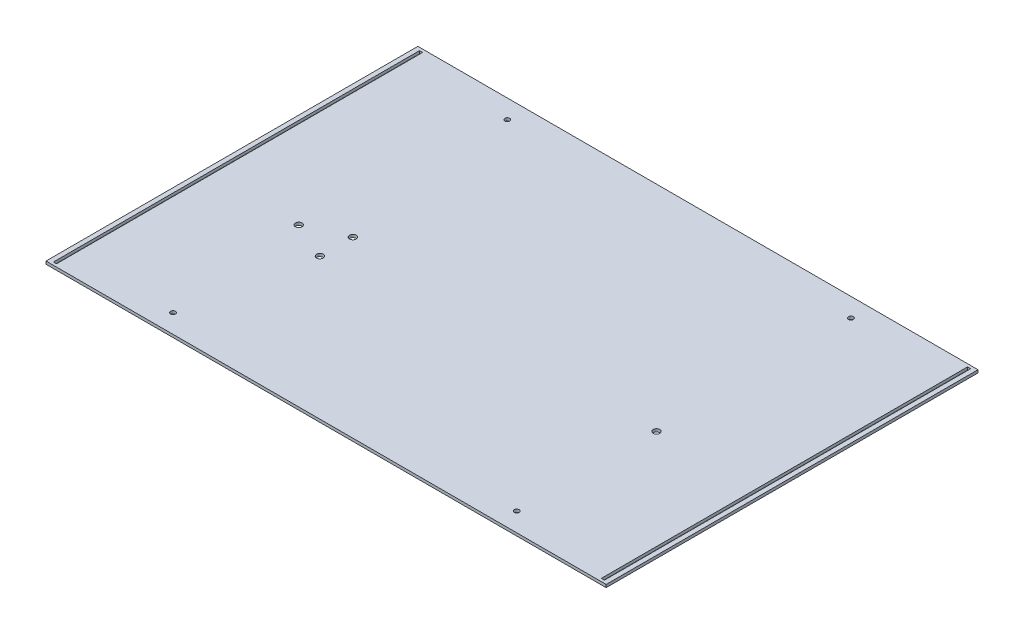
from build123d import *

# Parameters (mm, degrees)
SKETCH1_W               = 595
SKETCH1_H               = 395
BOSS_EXTRUDE1_DEPTH     = 3
CUT_EXTRUDE1_DEPTH      = 358.10152618
CUT_EXTRUDE1_DEPTH_BACK = 358.10152618
SKETCH2_R               = 3.55
CUT_EXTRUDE2_DEPTH      = 358.10152618
CUT_EXTRUDE2_DEPTH_BACK = 358.10152618
SKETCH3_W               = 3.3
SKETCH3_H               = 389
CUT_EXTRUDE3_DEPTH      = 358.10152618
CUT_EXTRUDE3_DEPTH_BACK = 358.10152618
SKETCH4_R               = 2.6


with BuildPart() as part:
    # Sketch1 → Boss-Extrude1 (new body)
    with BuildSketch(Plane(origin=(0, 0, 0), x_dir=(1, 0, 0), z_dir=(0, 1, 0))):
        Rectangle(SKETCH1_W, SKETCH1_H)
    extrude(amount=BOSS_EXTRUDE1_DEPTH)

    # Sketch2 → Cut-Extrude1 (cut, two sides: drawn at the far end of the back side and taken through both)
    with BuildSketch(Plane(origin=(0, 3, 0), x_dir=(1, 0, 0), z_dir=(0, 1, 0)).offset(-CUT_EXTRUDE1_DEPTH_BACK)):
        with Locations(Location((-196.5, -30, 0), (0, 0, 270))):
            Circle(SKETCH2_R)
        with Locations(Location((-156.5, -47.5, 0), (0, 0, 270))):
            Circle(SKETCH2_R)
        with Locations(Location((-156.5, -12.5, 0), (0, 0, 270))):
            Circle(SKETCH2_R)
        with Locations(Location((183.5, -30, 0), (0, 0, 270))):
            Circle(SKETCH2_R)
    extrude(amount=CUT_EXTRUDE1_DEPTH + CUT_EXTRUDE1_DEPTH_BACK, mode=Mode.SUBTRACT)

    # Sketch3 → Cut-Extrude2 (cut, two sides: drawn at the far end of the back side and taken through both)
    with BuildSketch(Plane(origin=(0, 3, 0), x_dir=(1, 0, 0), z_dir=(0, 1, 0)).offset(-CUT_EXTRUDE2_DEPTH_BACK)):
        with Locations((291, 0)):
            Rectangle(SKETCH3_W, SKETCH3_H)
        with Locations((-291, 0)):
            Rectangle(SKETCH3_W, SKETCH3_H)
    extrude(amount=CUT_EXTRUDE2_DEPTH + CUT_EXTRUDE2_DEPTH_BACK, mode=Mode.SUBTRACT)

    # Sketch4 → Cut-Extrude3 (cut, two sides: drawn at the far end of the back side and taken through both)
    with BuildSketch(Plane(origin=(0, 0, 0), x_dir=(-1, 0, 0), z_dir=(0, -1, 0)).offset(-CUT_EXTRUDE3_DEPTH_BACK)):
        with Locations(Location((-182.5, -177.5, 0), (0, 0, 90))):
            Circle(SKETCH4_R)
        with Locations(Location((182.5, -177.5, 0), (0, 0, 90))):
            Circle(SKETCH4_R)
        with Locations(Location((182.5, 177.5, 0), (0, 0, 90))):
            Circle(SKETCH4_R)
        with Locations(Location((-182.5, 177.5, 0), (0, 0, 90))):
            Circle(SKETCH4_R)
    extrude(amount=CUT_EXTRUDE3_DEPTH + CUT_EXTRUDE3_DEPTH_BACK, mode=Mode.SUBTRACT)


solid = part.part
